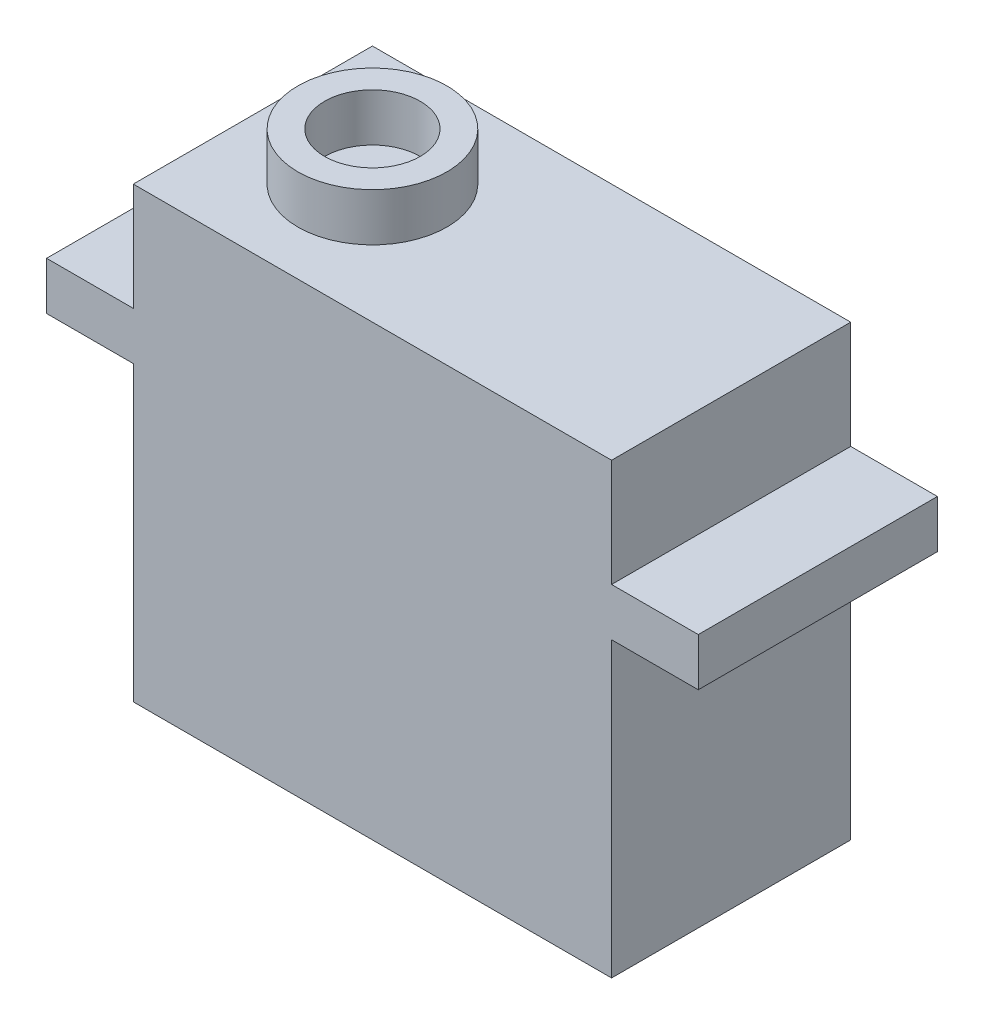
from build123d import *

# Parameters (mm, degrees)
SKETCH1_W           = 40
SKETCH1_H           = 20
BOSS_EXTRUDE1_DEPTH = 24.5
SKETCH2_W           = 54.5
SKETCH2_H           = 20
BOSS_EXTRUDE2_DEPTH = 4
SKETCH3_W           = 40
SKETCH3_H           = 37.5
BOSS_EXTRUDE3_DEPTH = 20
SKETCH8_R           = 6.232527985
SKETCH8_R_2         = 4
BOSS_EXTRUDE4_DEPTH = 4


with BuildPart() as part:
    # Sketch1 → Boss-Extrude1 (new body)
    with BuildSketch(Plane(origin=(0, 0, 0), x_dir=(1, 0, 0), z_dir=(0, 1, 0))):
        with Locations((20, 10)):
            Rectangle(SKETCH1_W, SKETCH1_H)
    extrude(amount=BOSS_EXTRUDE1_DEPTH)

    # Sketch2 → Boss-Extrude2 (add)
    with BuildSketch(Plane(origin=(0, 24.5, 0), x_dir=(1, 0, 0), z_dir=(0, 1, 0))):
        with Locations((20, 10)):
            Rectangle(SKETCH2_W, SKETCH2_H)
    extrude(amount=BOSS_EXTRUDE2_DEPTH)

    # Sketch3 → Boss-Extrude3 (add)
    with BuildSketch(Plane.XY):
        with Locations((20, 18.75)):
            Rectangle(SKETCH3_W, SKETCH3_H)
    extrude(amount=-BOSS_EXTRUDE3_DEPTH)

    # Sketch8 → Boss-Extrude4 (add)
    with BuildSketch(Plane(origin=(0, 37.5, 0), x_dir=(1, 0, 0), z_dir=(0, 1, 0))):
        with Locations(Location((10, 10, 0), (0, 0, 270))):
            Circle(SKETCH8_R)
        with Locations(Location((10, 10, 0), (0, 0, 270))):
            Circle(SKETCH8_R_2, mode=Mode.SUBTRACT)
    extrude(amount=BOSS_EXTRUDE4_DEPTH)


solid = part.part
